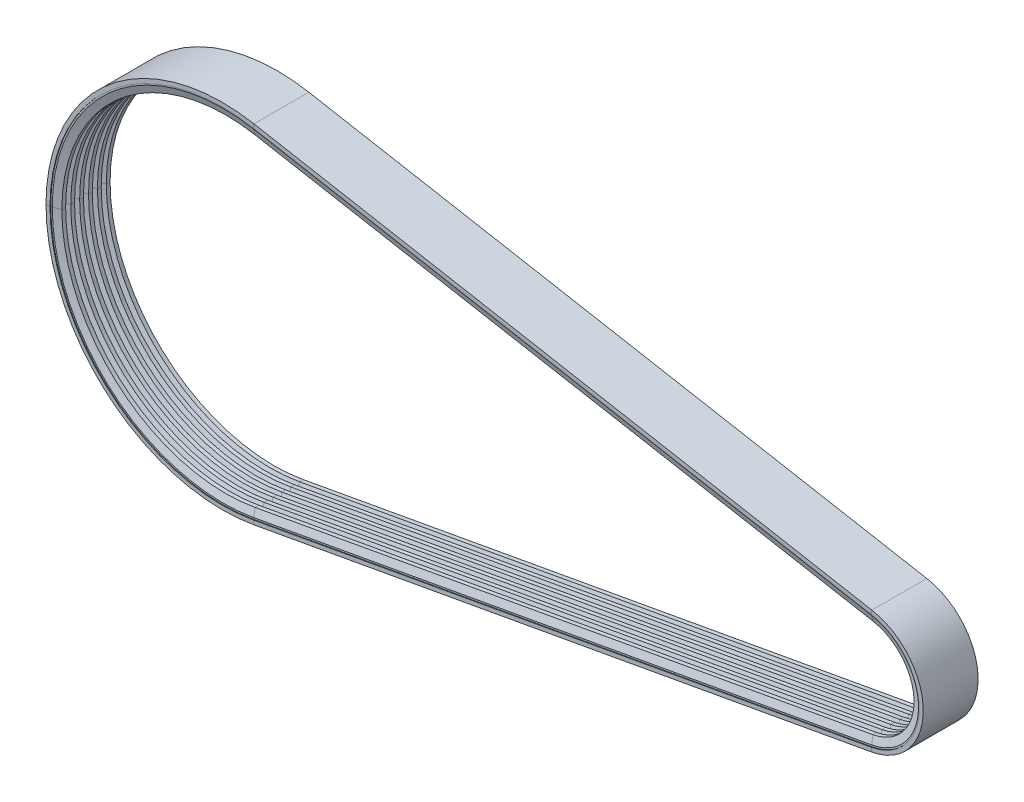
from build123d import *


with BuildPart() as part:
    # По траектории1: sweep along a path in Эскиз1
    with BuildLine(Plane.XY) as sweep_1_path:
        Line((-159.964285714, 44.276712795), (2.678571429, 14.758904265))
        ThreePointArc((2.678571429, 14.758904265), (15, 0), (2.678571429, -14.758904265))
        Line((2.678571429, -14.758904265), (-159.964285714, -44.276712795))
        ThreePointArc((-159.964285714, -44.276712795), (-213, 0), (-159.964285714, 44.276712795))
    # Эскиз2 → По траектории1 (sweep)
    with BuildSketch(Plane(origin=(0, 0, 0), x_dir=(1, 0, 0), z_dir=(0, 1, 0))):
        Polygon((-213, 0), (-211.15, 0.673344933), (-211.15, 1.666655067), (-213, 2.34), (-211.15, 3.013344933), (-211.15, 4.006655067), (-213, 4.68), (-211.15, 5.353344933), (-211.15, 6.346655067), (-213, 7.02), (-213.4, 7.02), (-213.4, 7.22), (-214.45, 7.22), (-214.45, -7.22), (-213.4, -7.22), (-213.4, -7.02), (-213, -7.02), (-211.15, -6.346655067), (-211.15, -5.353344933), (-213, -4.68), (-211.15, -4.006655067), (-211.15, -3.013344933), (-213, -2.34), (-211.15, -1.666655067), (-211.15, -0.673344933), align=None)
    sweep(path=sweep_1_path.line)


solid = part.part
